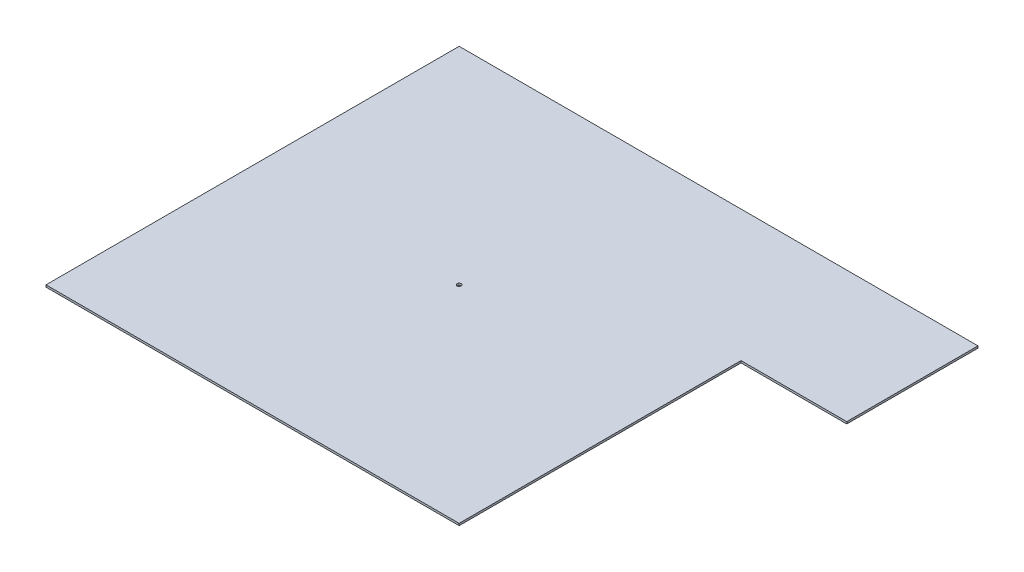
from build123d import *

# Parameters (mm, degrees)
SKETCH1_W           = 5137.15
SKETCH1_H           = 5137.15
BOSS_EXTRUDE1_DEPTH = 25.4
SKETCH2_R           = 25.4
CUT_EXTRUDE1_DEPTH  = 3633.602403409
SKETCH3_W           = 1314.45
SKETCH3_H           = 1631.95
BOSS_EXTRUDE2_DEPTH = 25.4


with BuildPart() as part:
    # Sketch1 → Boss-Extrude1 (new body)
    with BuildSketch(Plane(origin=(0, 0, 0), x_dir=(1, 0, 0), z_dir=(0, 1, 0))):
        Rectangle(SKETCH1_W, SKETCH1_H)
    extrude(amount=BOSS_EXTRUDE1_DEPTH)

    # Sketch2 → Cut-Extrude1 (cut, through all)
    with BuildSketch(Plane.XZ):
        with Locations(Location((0, 0, 0), (0, 0, 270))):
            Circle(SKETCH2_R)
    extrude(amount=-CUT_EXTRUDE1_DEPTH, mode=Mode.SUBTRACT)

    # Sketch3 → Boss-Extrude2 (add)
    with BuildSketch(Plane.XZ):
        with Locations((3225.8, -1752.6)):
            Rectangle(SKETCH3_W, SKETCH3_H)
    extrude(amount=-BOSS_EXTRUDE2_DEPTH)


solid = part.part
